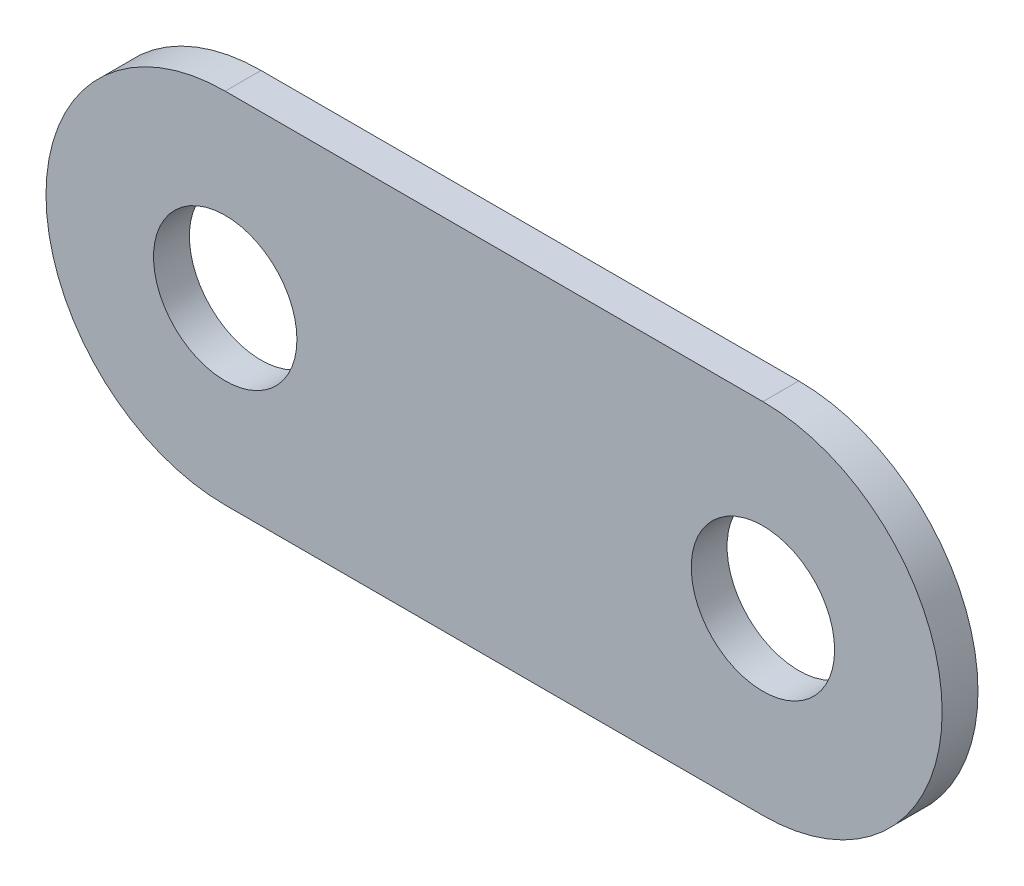
from build123d import *

# Parameters (mm, degrees)
SKETCH_1_R      = 2
EXTRUDE_1_DEPTH = 1


with BuildPart() as part:
    # Эскиз1 → Бобышка-Вытянуть1 (new body)
    with BuildSketch(Plane.XY):
        with BuildLine():
            Line((5, 0), (20, 0))
            ThreePointArc((20, 0), (23.535533906, -1.464466094), (25, -5))
            ThreePointArc((25, -5), (23.535533906, -8.535533906), (20, -10))
            Line((20, -10), (5, -10))
            ThreePointArc((5, -10), (1.464466094, -8.535533906), (0, -5))
            ThreePointArc((0, -5), (1.464466094, -1.464466094), (5, 0))
        make_face()
        with Locations((5, -5)):
            Circle(SKETCH_1_R, mode=Mode.SUBTRACT)
        with Locations((20, -5)):
            Circle(SKETCH_1_R, mode=Mode.SUBTRACT)
    extrude(amount=EXTRUDE_1_DEPTH)


solid = part.part
